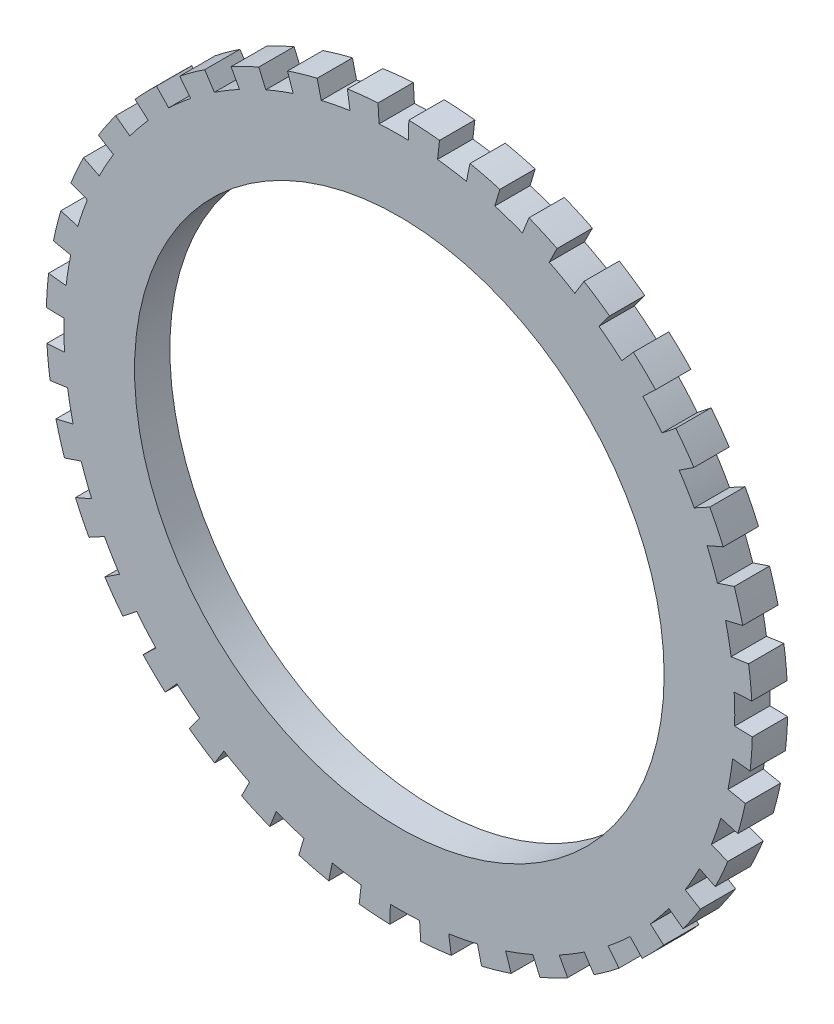
from build123d import *

# Parameters (mm, degrees)
SKETCH1_R           = 20
SKETCH1_R_2         = 15
BOSS_EXTRUDE1_DEPTH = 2
CUT_EXTRUDE1_START  = -2
CUT_EXTRUDE1_DEPTH  = 2
CIRPATTERN1_COUNT   = 36
SCALE1_SCALE        = 1.9329
SCALE2_SCALE        = 1.5


with BuildPart() as part:
    # Sketch1 → Boss-Extrude1 (new body)
    with BuildSketch(Plane.XY):
        Circle(SKETCH1_R)
        Circle(SKETCH1_R_2, mode=Mode.SUBTRACT)
    extrude(amount=BOSS_EXTRUDE1_DEPTH)

    # Sketch2 → Cut-Extrude1 (cut)
    with BuildSketch(Plane.XY.offset(2).offset(CUT_EXTRUDE1_START)):
        with BuildLine():
            Line((-18.47787485, -4.423589156), (-19.450394579, -4.656409638))
            ThreePointArc((-19.450394579, -4.656409638), (-19.634991849, -3.803563472), (-19.782212796, -2.943477007))
            Line((-19.782212796, -2.943477007), (-18.793102156, -2.796303156))
            ThreePointArc((-18.793102156, -2.796303156), (-18.653242257, -3.613385298), (-18.47787485, -4.423589156))
        make_face()
    cut_extrude1 = extrude(amount=CUT_EXTRUDE1_DEPTH, mode=Mode.SUBTRACT)

    # CirPattern1: Cut-Extrude1 ×36 about axis
    cirpattern1_axis = Axis((0, 0, 0), (0, 0, 1))
    for i in range(1, CIRPATTERN1_COUNT):
        add(cut_extrude1.rotate(cirpattern1_axis, i * 360 / CIRPATTERN1_COUNT), mode=Mode.SUBTRACT)


with BuildPart() as part_1:
    # Scale1: scaled about (0, 0, 1)
    add(part.part.scale(SCALE1_SCALE).moved(Location((0, 0, -0.9329))))


with BuildPart() as part_2:
    # Scale2: scaled about (0, 0, 1)
    add(part_1.part.scale(SCALE2_SCALE).moved(Location((0, 0, -0.5))))


solid = part_2.part
